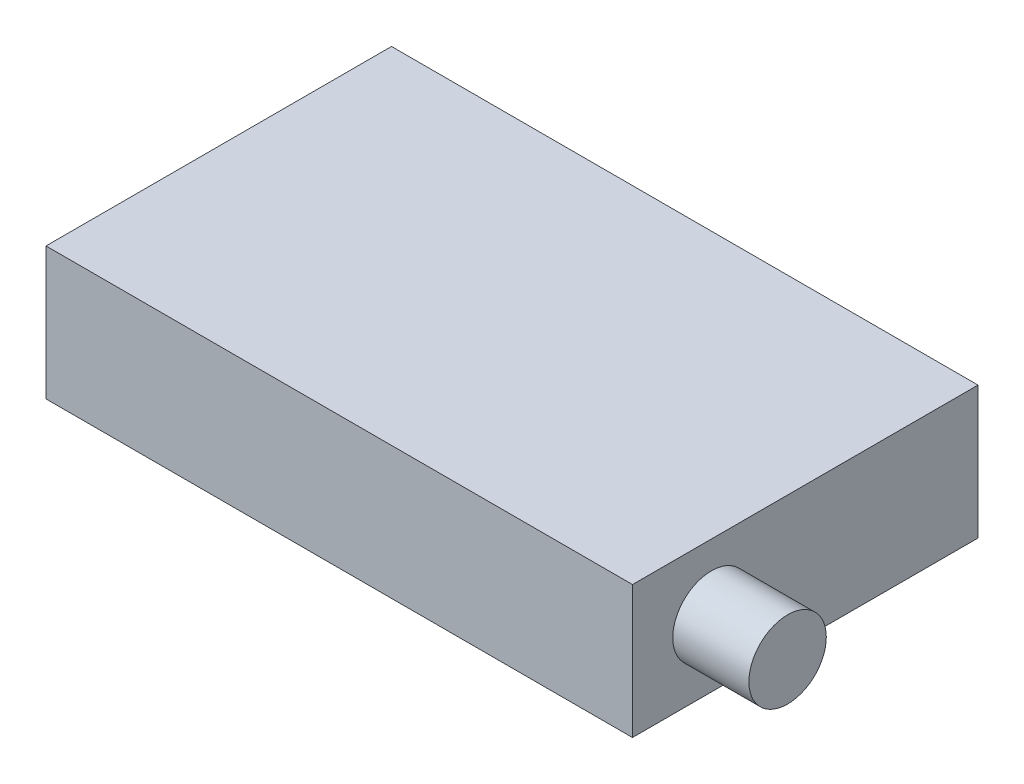
from build123d import *

# Parameters (mm, degrees)
SKETCH1_W           = 47.36
SKETCH1_H           = 27.9
BOSS_EXTRUDE1_DEPTH = 5.35
SKETCH2_R           = 3.125
BOSS_EXTRUDE2_DEPTH = 6.15
SKETCH3_W           = 11.2
SKETCH3_H           = 5
CUT_EXTRUDE1_DEPTH  = 1
SKETCH5_W           = 8.9
SKETCH5_H           = 3.2
CUT_EXTRUDE2_DEPTH  = 1


with BuildPart() as part:
    # Sketch1 → Boss-Extrude1 (new, symmetric)
    with BuildSketch(Plane(origin=(0, 0, 0), x_dir=(1, 0, 0), z_dir=(0, 1, 0))):
        Rectangle(SKETCH1_W, SKETCH1_H)
    extrude(amount=BOSS_EXTRUDE1_DEPTH, both=True)

    # Sketch2 → Boss-Extrude2 (add)
    with BuildSketch(Plane(origin=(23.68, 0, 0), x_dir=(0, 0, -1), z_dir=(1, 0, 0))):
        with Locations(Location((-7.575, 0, 0), (0, 0, 180))):
            Circle(SKETCH2_R)
    extrude(amount=BOSS_EXTRUDE2_DEPTH)

    # Sketch3 → Cut-Extrude1 (cut)
    with BuildSketch(Plane.ZY.offset(23.68)):
        with Locations((-4.65, -1.55)):
            Rectangle(SKETCH3_W, SKETCH3_H)
    extrude(amount=-CUT_EXTRUDE1_DEPTH, mode=Mode.SUBTRACT)

    # Sketch5 → Cut-Extrude2 (cut)
    with BuildSketch(Plane.ZY.offset(23.68)):
        with Locations((5.4, -0.65)):
            Rectangle(SKETCH5_W, SKETCH5_H)
    extrude(amount=-CUT_EXTRUDE2_DEPTH, mode=Mode.SUBTRACT)


solid = part.part
